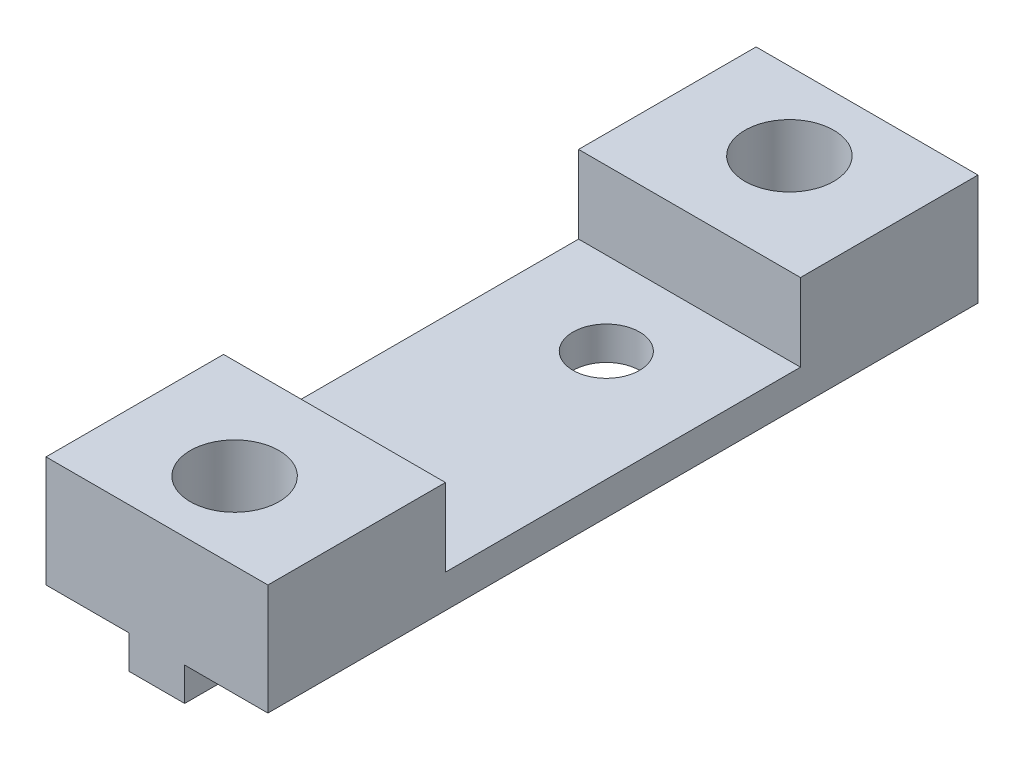
from build123d import *

# Parameters (mm, degrees)
SKETCH1_W               = 20
SKETCH1_H               = 30
BOSS_EXTRUDE1_DEPTH     = 3
SKETCH2_W               = 5
SKETCH2_H               = 12
BOSS_EXTRUDE2_DEPTH     = 3
SKETCH3_R               = 7
SKETCH3_R_2             = 4
BOSS_EXTRUDE3_DEPTH     = 7
SKETCH4_R               = 4
BOSS_EXTRUDE4_DEPTH     = 1
CUT_EXTRUDE1_DEPTH      = 20.339079606
CUT_EXTRUDE1_DEPTH_BACK = 20.339079606
SKETCH5_R               = 3
SKETCH6_R               = 7
SKETCH6_R_2             = 4
BOSS_EXTRUDE6_DEPTH     = 7
SKETCH7_W               = 20
SKETCH7_H               = 3
BOSS_EXTRUDE7_DEPTH     = 19
SKETCH8_W               = 5
SKETCH8_H               = 3
BOSS_EXTRUDE8_DEPTH     = 12


with BuildPart() as part:
    # Sketch1 → Boss-Extrude1 (new body)
    with BuildSketch(Plane(origin=(0, 0, 0), x_dir=(1, 0, 0), z_dir=(0, 1, 0))):
        Rectangle(SKETCH1_W, SKETCH1_H)
    boss_extrude1 = extrude(amount=BOSS_EXTRUDE1_DEPTH)

    # Sketch2 → Boss-Extrude2 (add)
    with BuildSketch(Plane.XZ):
        with Locations((0, -9)):
            Rectangle(SKETCH2_W, SKETCH2_H)
    boss_extrude2 = extrude(amount=BOSS_EXTRUDE2_DEPTH)

    # Sketch3 → Boss-Extrude3 (add)
    with BuildSketch(Plane(origin=(0, 3, 0), x_dir=(1, 0, 0), z_dir=(0, 1, 0))):
        with Locations(Location((0, 8, 0), (0, 0, 90))):
            Circle(SKETCH3_R)
        with Locations(Location((0, 8, 0), (0, 0, 270))):
            Circle(SKETCH3_R_2, mode=Mode.SUBTRACT)
    boss_extrude3 = extrude(amount=BOSS_EXTRUDE3_DEPTH)

    # Sketch4 → Boss-Extrude4 (add)
    with BuildSketch(Plane(origin=(0, 3, 0), x_dir=(1, 0, 0), z_dir=(0, 1, 0))):
        with Locations(Location((0, 8, 0), (0, 0, 270))):
            Circle(SKETCH4_R)
    boss_extrude4 = extrude(amount=BOSS_EXTRUDE4_DEPTH)

    # Sketch5 → Cut-Extrude1 (cut, two sides: drawn at the far end of the back side and taken through both)
    with BuildSketch(Plane(origin=(0, 3, 0), x_dir=(1, 0, 0), z_dir=(0, 1, 0)).offset(-CUT_EXTRUDE1_DEPTH_BACK)):
        with Locations(Location((0, -8.5, 0), (0, 0, 90))):
            Circle(SKETCH5_R)
    extrude(amount=CUT_EXTRUDE1_DEPTH + CUT_EXTRUDE1_DEPTH_BACK, mode=Mode.SUBTRACT)

    # Sketch6 → Boss-Extrude6 (add)
    # profile 1 of 2: a face of its own
    with BuildSketch(Plane(origin=(0, 3, 0), x_dir=(1, 0, 0), z_dir=(0, 1, 0))):
        Polygon((0, 15), (-10, 15), (-10, -1), (10, -1), (10, 15), align=None)
        with BuildLine():
            ThreePointArc((7, 8), (-4.949747468, 3.050252532), (0, 15))
            ThreePointArc((0, 15), (4.949747468, 12.949747468), (7, 8))
        make_face(mode=Mode.SUBTRACT)
    # profile 2 of 2: a face of its own
    with BuildSketch(Plane(origin=(0, 3, 0), x_dir=(1, 0, 0), z_dir=(0, 1, 0))):
        with Locations((0, 8)):
            Circle(SKETCH6_R)
        with Locations(Location((0, 8, 0), (0, 0, 270))):
            Circle(SKETCH6_R_2, mode=Mode.SUBTRACT)
    boss_extrude6 = extrude(amount=BOSS_EXTRUDE6_DEPTH)

    # Sketch7 → Boss-Extrude7 (add)
    with BuildSketch(Plane.XY.offset(15)):
        with Locations((0, 1.5)):
            Rectangle(SKETCH7_W, SKETCH7_H)
    extrude(amount=BOSS_EXTRUDE7_DEPTH)

    # Mirror3: Boss-Extrude1, Boss-Extrude2, Boss-Extrude3, Boss-Extrude4, Boss-Extrude6 across plane
    add(boss_extrude1.mirror(Plane.XY.offset(17)))
    add(boss_extrude2.mirror(Plane.XY.offset(17)))
    add(boss_extrude3.mirror(Plane.XY.offset(17)))
    add(boss_extrude4.mirror(Plane.XY.offset(17)))
    add(boss_extrude6.mirror(Plane.XY.offset(17)))

    # Sketch8 → Boss-Extrude8 (add)
    with BuildSketch(Plane(origin=(0, 0, 37), x_dir=(-1, 0, 0), z_dir=(0, 0, -1))):
        with Locations((0, -1.5)):
            Rectangle(SKETCH8_W, SKETCH8_H)
    extrude(amount=BOSS_EXTRUDE8_DEPTH)


solid = part.part
